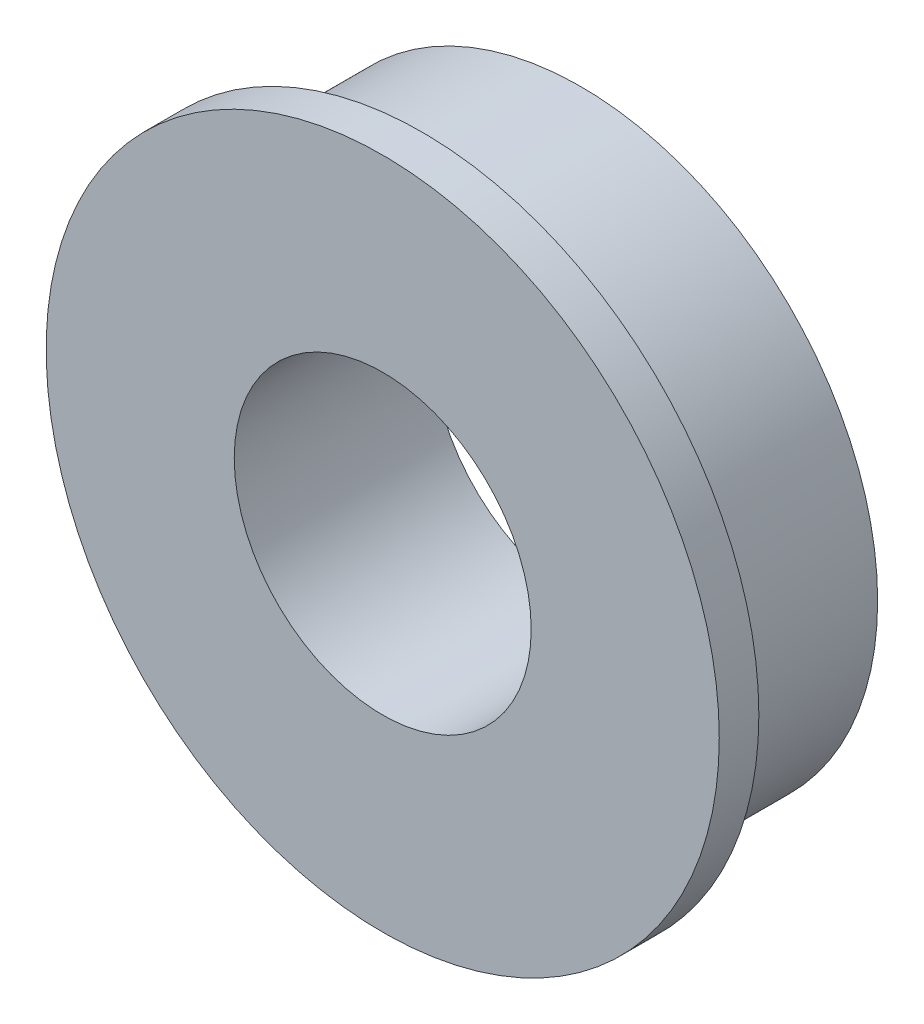
from build123d import *

# Parameters (mm, degrees)
SKETCH_1_R      = 6
SKETCH_1_R_2    = 3
EXTRUDE_1_DEPTH = 3.2
SKETCH_2_R      = 6.8
SKETCH_2_R_2    = 3
EXTRUDE_2_DEPTH = 0.8


with BuildPart() as part:
    # 草图1 → 凸台-拉伸1 (new body)
    with BuildSketch(Plane.XY):
        Circle(SKETCH_1_R)
        Circle(SKETCH_1_R_2, mode=Mode.SUBTRACT)
    extrude(amount=EXTRUDE_1_DEPTH)

    # 草图2 → 凸台-拉伸2 (add)
    with BuildSketch(Plane.XY.offset(3.2)):
        Circle(SKETCH_2_R)
        Circle(SKETCH_2_R_2, mode=Mode.SUBTRACT)
    extrude(amount=EXTRUDE_2_DEPTH)


solid = part.part
